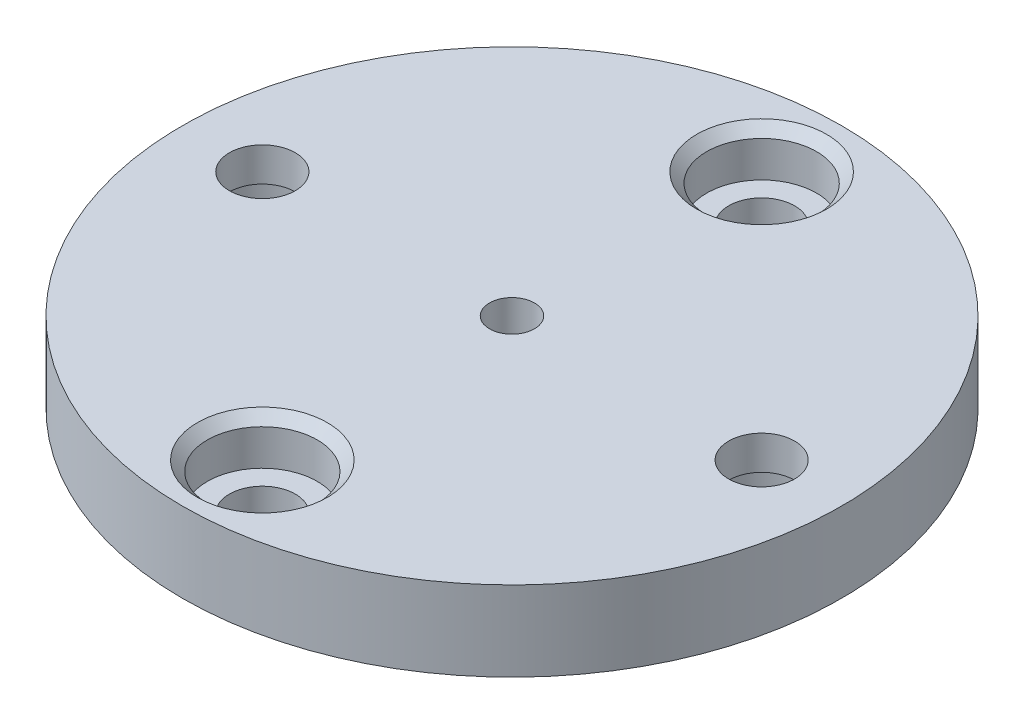
from build123d import *

# Parameters (mm, degrees)
SKETCH1_R                                           = 33
BOSS_EXTRUDE1_DEPTH                                 = 8
SKETCH2_R                                           = 15.5
BOSS_EXTRUDE2_DEPTH                                 = 3
SKETCH4_R                                           = 3.05
CUT_EXTRUDE2_DEPTH                                  = 5
CHAMFER1_SIZE                                       = 0.5
CBORE_FOR_M6_HEX_SOCKET_THIN_HEAD_CA_2_COUNT        = 2
CBORE_FOR_M6_HEX_SOCKET_THIN_HEAD_CA_2_PITCH        = 50
CBORE_FOR_M6_HEX_SOCKET_THIN_HEAD_CA_3_A_COUNT      = 2
CBORE_FOR_M6_HEX_SOCKET_THIN_HEAD_CA_3_A_PITCH      = 50
CSK_FOR_M4_COUNTERSUNK_FLAT_HEAD_SCREW1_D           = 4.5
CSK_FOR_M4_COUNTERSUNK_FLAT_HEAD_SCREW1_CSINK_D     = 9.4
CSK_FOR_M4_COUNTERSUNK_FLAT_HEAD_SCREW1_CSINK_ANGLE = 90


with BuildPart() as part:
    # Sketch1 → Boss-Extrude1 (new body)
    with BuildSketch(Plane(origin=(0, 0, 0), x_dir=(1, 0, 0), z_dir=(0, 1, 0))):
        with Locations(Location((0, 0, 0), (0, 0, 270))):
            Circle(SKETCH1_R)
    extrude(amount=BOSS_EXTRUDE1_DEPTH)

    # Sketch2 → Boss-Extrude2 (add)
    with BuildSketch(Plane(origin=(0, 0, 0), x_dir=(-1, 0, 0), z_dir=(0, -1, 0))):
        with Locations(Location((0, 0, 0), (0, 0, 90))):
            Circle(SKETCH2_R)
    extrude(amount=BOSS_EXTRUDE2_DEPTH)

    # Sketch4 → Cut-Extrude2 (cut)
    with BuildSketch(Plane.XZ):
        with Locations(Location((-17.67766953, -17.67766953, 0), (0, 0, 270))):
            Circle(SKETCH4_R)
    extrude(amount=-CUT_EXTRUDE2_DEPTH, mode=Mode.SUBTRACT)

    # Chamfer1
    chamfer1_edges = [part.edges().sort_by_distance(p)[0] for p in [
        (0, -3, 15.5),
    ]]
    chamfer(chamfer1_edges, length=CHAMFER1_SIZE)

    # Sketch8 → CBORE for M6 Hex Socket Thin Head Cap Sc (revolve, cut)
    with BuildSketch(Plane(origin=(-25, 0, 0), x_dir=(0, 0, -1), z_dir=(1, 0, 0))):
        Polygon((0, 0), (0, 8), (3.3, 8), (3.3, 4.6), (5.5, 4.6), (5.5, 1), (6.5, 0), align=None)
    cbore_for_m6_hex_socket_thin_head_cap_sc = revolve(axis=Axis((-25, -6.35, 0), (0, 1, 0)), mode=Mode.SUBTRACT)

    # CBORE for M6 Hex Socket Thin Head Ca 2: CBORE for M6 Hex Socket Thin Head Cap Sc ×2
    with Locations(*[(i * CBORE_FOR_M6_HEX_SOCKET_THIN_HEAD_CA_2_PITCH, 0, 0) for i in range(1, CBORE_FOR_M6_HEX_SOCKET_THIN_HEAD_CA_2_COUNT)]):
        add(cbore_for_m6_hex_socket_thin_head_cap_sc, mode=Mode.SUBTRACT)

    # Sketch10 → CBORE for M6 Hex Socket Thin Head Ca 3 (revolve, cut)
    with BuildSketch(Plane(origin=(0, 8, -25), x_dir=(0, 0, 1), z_dir=(1, 0, 0))):
        Polygon((0, 0), (0, 11), (3.3, 11), (3.3, 4.6), (5.5, 4.6), (5.5, 1), (6.5, 0), align=None)
    cbore_for_m6_hex_socket_thin_head_ca_3 = revolve(axis=Axis((0, 14.35, -25), (0, -1, 0)), mode=Mode.SUBTRACT)

    # CBORE for M6 Hex Socket Thin Head Ca 3 a: CBORE for M6 Hex Socket Thin Head Ca 3 ×2
    with Locations(*[(0, 0, i * CBORE_FOR_M6_HEX_SOCKET_THIN_HEAD_CA_3_A_PITCH) for i in range(1, CBORE_FOR_M6_HEX_SOCKET_THIN_HEAD_CA_3_A_COUNT)]):
        add(cbore_for_m6_hex_socket_thin_head_ca_3, mode=Mode.SUBTRACT)

    # CSK for M4 Countersunk Flat Head Screw1 (through all)
    with Locations(Plane(origin=(0, -3, 0), x_dir=(-1, 0, 0), z_dir=(0, -1, 0))):
        with Locations((0, 0)):
            CounterSinkHole(CSK_FOR_M4_COUNTERSUNK_FLAT_HEAD_SCREW1_D / 2, CSK_FOR_M4_COUNTERSUNK_FLAT_HEAD_SCREW1_CSINK_D / 2, counter_sink_angle=CSK_FOR_M4_COUNTERSUNK_FLAT_HEAD_SCREW1_CSINK_ANGLE)


solid = part.part
